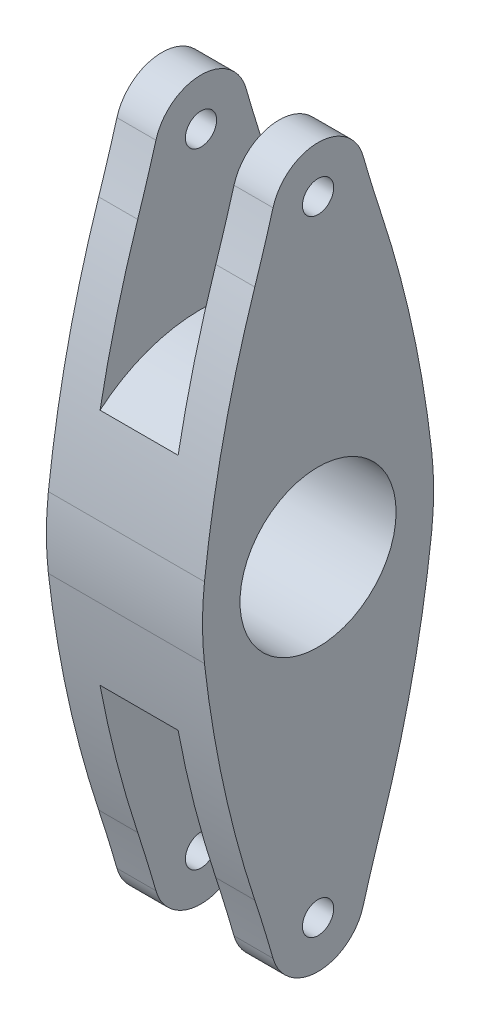
from build123d import *

# Parameters (mm, degrees)
CROQUIS1_R              = 2.5
CROQUIS1_R_2            = 0.5
SALIENTE_EXTRUIR1_DEPTH = 5
REDONDEO1_R             = 50
REDONDEO2_R             = 10
CORTAR_EXTRUIR1_START   = -2.5
CORTAR_EXTRUIR1_DEPTH   = 1.25


with BuildPart() as part:
    # Croquis1 → Saliente-Extruir1 (new body)
    with BuildSketch(Plane(origin=(0, 0, 0), x_dir=(0, 0, -1), z_dir=(1, 0, 0))):
        with BuildLine():
            ThreePointArc((-1.5, -10), (0, -11.5), (1.5, -10))
            ThreePointArc((1.5, -10), (2.97123258, -5.077902331), (3.75, 0))
            ThreePointArc((3.75, 0), (2.97123258, 5.077902331), (1.5, 10))
            ThreePointArc((1.5, 10), (0, 11.5), (-1.5, 10))
            ThreePointArc((-1.5, 10), (-2.97123258, 5.077902331), (-3.75, 0))
            ThreePointArc((-3.75, 0), (-2.97123258, -5.077902331), (-1.5, -10))
        make_face()
        Circle(CROQUIS1_R, mode=Mode.SUBTRACT)
        with Locations((0, 10)):
            Circle(CROQUIS1_R_2, mode=Mode.SUBTRACT)
        with Locations((0, -10)):
            Circle(CROQUIS1_R_2, mode=Mode.SUBTRACT)
    extrude(amount=SALIENTE_EXTRUIR1_DEPTH)

    # Redondeo1
    redondeo1_edges = [part.edges().sort_by_distance(p)[0] for p in [
        (2.5, 10, 1.5),
        (2.5, 10, -1.5),
        (2.5, -10, -1.5),
        (2.5, -10, 1.5),
    ]]
    fillet(redondeo1_edges, radius=REDONDEO1_R)

    # Redondeo2
    redondeo2_edges = [part.edges().sort_by_distance(p)[0] for p in [
        (2.5, 0, -3.75),
        (2.5, 0, 3.75),
    ]]
    fillet(redondeo2_edges, radius=REDONDEO2_R)

    # Croquis2 → Cortar-Extruir1 (cut, symmetric)
    with BuildSketch(Plane.ZY.offset(CORTAR_EXTRUIR1_START)):
        with BuildLine():
            ThreePointArc((-3.232551289, -3.814526467), (0, -5), (3.232551289, -3.814526467))
            ThreePointArc((3.232551289, -3.814526467), (2.705759395, -6.179171669), (2.02610144, -8.504493518))
            ThreePointArc((2.02610144, -8.504493518), (1.724946708, -9.454502859), (1.442786447, -10.410325806))
            ThreePointArc((1.442786447, -10.410325806), (0, -11.5), (-1.442786447, -10.410325806))
            ThreePointArc((-1.442786447, -10.410325806), (-1.724946708, -9.454502859), (-2.02610144, -8.504493518))
            ThreePointArc((-2.02610144, -8.504493518), (-2.705759395, -6.179171669), (-3.232551289, -3.814526467))
        make_face()
        with BuildLine():
            ThreePointArc((3.232551289, 3.814526467), (0, 5), (-3.232551289, 3.814526467))
            ThreePointArc((-3.232551289, 3.814526467), (-2.705759395, 6.179171669), (-2.02610144, 8.504493518))
            ThreePointArc((-2.02610144, 8.504493518), (-1.724946708, 9.454502859), (-1.442786447, 10.410325806))
            ThreePointArc((-1.442786447, 10.410325806), (0, 11.5), (1.442786447, 10.410325806))
            ThreePointArc((1.442786447, 10.410325806), (1.724946708, 9.454502859), (2.02610144, 8.504493518))
            ThreePointArc((2.02610144, 8.504493518), (2.705759395, 6.179171669), (3.232551289, 3.814526467))
        make_face()
    extrude(amount=CORTAR_EXTRUIR1_DEPTH, both=True, mode=Mode.SUBTRACT)


solid = part.part
